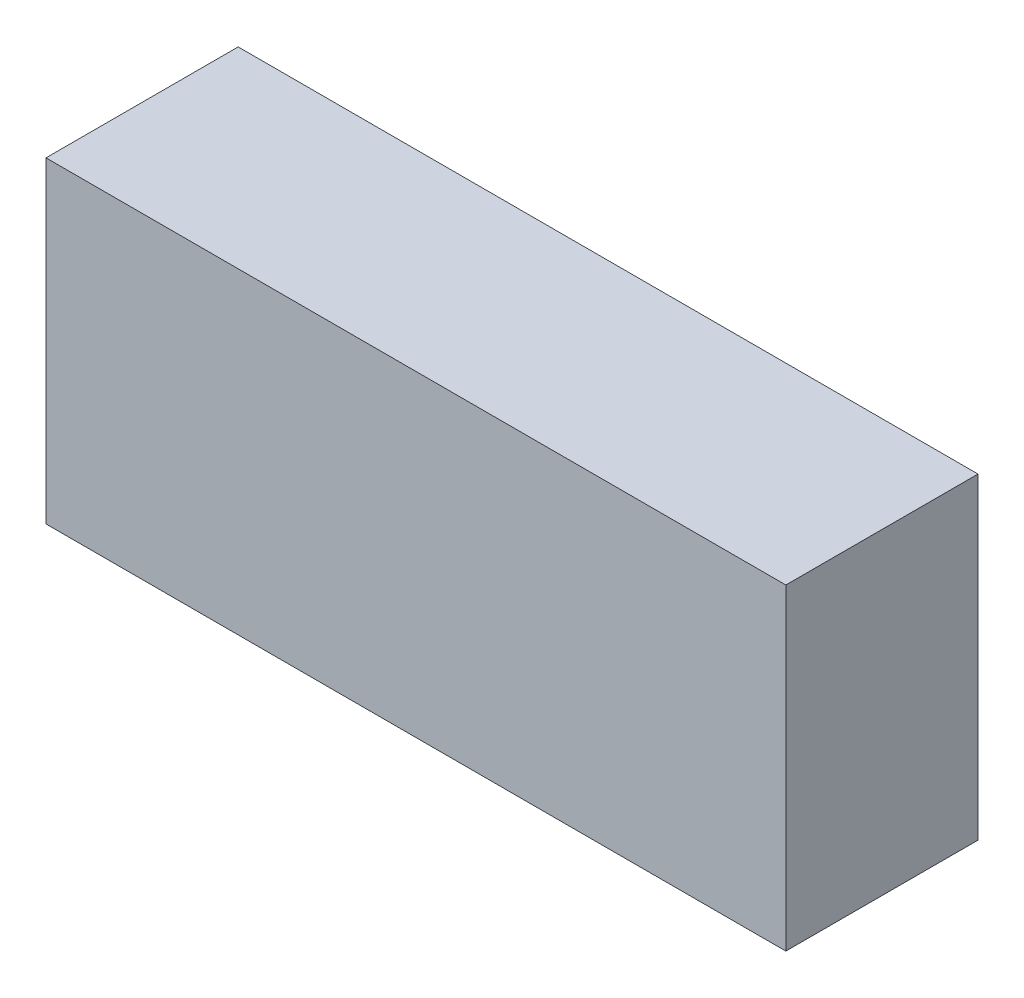
from build123d import *

# Parameters (mm, degrees)
ESQUISSE1_W        = 77
ESQUISSE1_H        = 33
BOSS_EXTRU_1_DEPTH = 20


with BuildPart() as part:
    # Esquisse1 → Boss.-Extru.1 (new body)
    with BuildSketch(Plane.XY):
        with Locations((1.588404594, 1.341463415)):
            Rectangle(ESQUISSE1_W, ESQUISSE1_H)
    extrude(amount=BOSS_EXTRU_1_DEPTH)


solid = part.part
